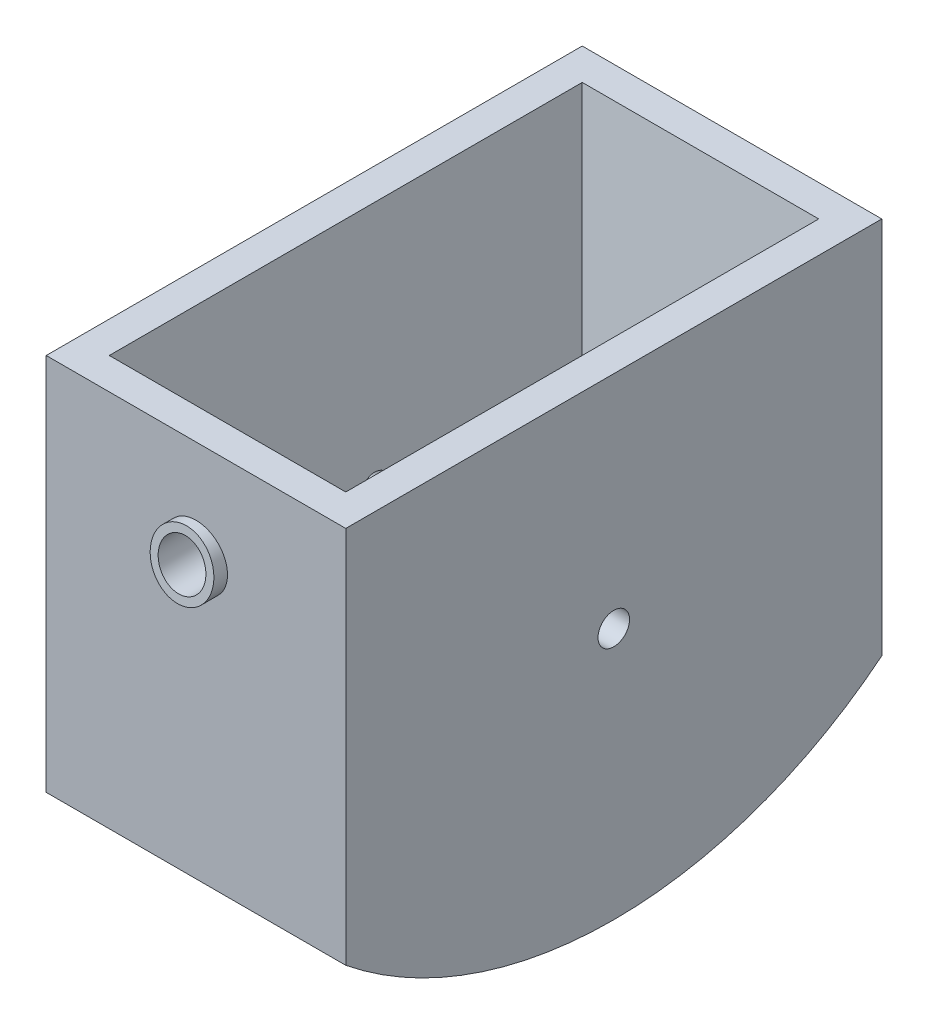
from build123d import *

# Parameters (mm, degrees)
SKETCH1_W                    = 190
SKETCH1_H                    = 340
BOSS_EXTRUDE1_DEPTH          = 300
SKETCH2_R                    = 20
SKETCH2_R_2                  = 15
BOSS_EXTRUDE2_DEPTH          = 57
CUT_EXTRUDE1_START           = -190
SKETCH5_R                    = 10
CUT_EXTRUDE1_DEPTH           = 612.460555687
CUT_EXTRUDE2_DEPTH           = 422.460555687
CUT_EXTRUDE6_START           = -236
CUT_EXTRUDE6_DEPTH           = 236
SKETCH10_OUTSIDE_W           = 383.134
SKETCH10_OUTSIDE_H           = 590.134
SKETCH10_OUTSIDE_W_2         = 190
SKETCH10_OUTSIDE_H_2         = 340
CUT_EXTRUDE7_DEPTH           = 301
CUT_EXTRUDE7_DRAFT           = -8
SKETCH10_OUTSIDE_W_3         = 150
SKETCH10_OUTSIDE_H_3         = 300
CUT_EXTRUDE7_PROFILE_2_DEPTH = 301
CUT_EXTRUDE7_PROFILE_2_DRAFT = -8


with BuildPart() as part:
    # Sketch1 → Boss-Extrude1 (new body)
    with BuildSketch(Plane(origin=(0, 0, 0), x_dir=(1, 0, 0), z_dir=(0, 1, 0))):
        Rectangle(SKETCH1_W, SKETCH1_H)
    extrude(amount=BOSS_EXTRUDE1_DEPTH)

    # Sketch2 → Boss-Extrude2 (add)
    with BuildSketch(Plane.XY.offset(170)):
        with Locations(Location((0, 237, 0), (0, 0, 180))):
            Circle(SKETCH2_R)
        with Locations(Location((0, 237, 0), (0, 0, 180))):
            Circle(SKETCH2_R_2, mode=Mode.SUBTRACT)
    extrude(amount=BOSS_EXTRUDE2_DEPTH)

    # Sketch5 → Cut-Extrude1 (cut, through all)
    with BuildSketch(Plane.ZY.offset(95).offset(CUT_EXTRUDE1_START)):
        with Locations((0, 160)):
            Circle(SKETCH5_R)
    extrude(amount=CUT_EXTRUDE1_DEPTH, mode=Mode.SUBTRACT)

    # Sketch9 → Cut-Extrude2 (cut, through all)
    with BuildSketch(Plane.ZY.offset(95)):
        with BuildLine():
            ThreePointArc((0, 0), (-90.138848958, 15.439927953), (-170, 60))
            Line((-170, 60), (-170, 0))
            Line((-170, 0), (0, 0))
        make_face()
        with BuildLine():
            ThreePointArc((170, 60), (90.138848958, 15.439927953), (0, 0))
            Line((0, 0), (170, 0))
            Line((170, 0), (170, 60))
        make_face()
    extrude(amount=-CUT_EXTRUDE2_DEPTH, mode=Mode.SUBTRACT)

    # Sketch2<3> → Cut-Extrude6 (cut)
    with BuildSketch(Plane.XY.offset(170).offset(CUT_EXTRUDE6_START)):
        with BuildLine():
            ThreePointArc((-15, 237), (0, 222), (15, 237))
            Line((15, 237), (-15, 237))
        make_face()
        with BuildLine():
            Line((-15, 237), (15, 237))
            ThreePointArc((15, 237), (0, 252), (-15, 237))
        make_face()
    extrude(amount=CUT_EXTRUDE6_DEPTH, mode=Mode.SUBTRACT)


with BuildPart() as cut_extrude7_tool:
    # Sketch10 outside → Cut-Extrude7 (with draft: the straight prism first)
    with BuildSketch(Plane(origin=(0, 300, 0), x_dir=(1, 0, 0), z_dir=(0, 1, 0))):
        with Locations((0, -28.5)):
            Rectangle(SKETCH10_OUTSIDE_W, SKETCH10_OUTSIDE_H)
        Rectangle(SKETCH10_OUTSIDE_W_2, SKETCH10_OUTSIDE_H_2, mode=Mode.SUBTRACT)
    extrude(amount=-CUT_EXTRUDE7_DEPTH)
    # Cut-Extrude7: the draft: its side faces are tilted about the plane it starts from
    cut_extrude7_sides = [cut_extrude7_tool.faces().sort_by_distance(p)[0] for p in [
        (0, 149.5, 323.567),
        (191.567, 149.5, 28.5),
        (0, 149.5, -266.567),
        (-191.567, 149.5, 28.5),
        (0, 149.5, -170),
        (95, 149.5, 0),
        (0, 149.5, 170),
        (-95, 149.5, 0),
    ]]
    draft(cut_extrude7_sides, Plane(origin=(0, 300, 0), x_dir=(1, 0, 0), z_dir=(0, 1, 0)), CUT_EXTRUDE7_DRAFT)


with BuildPart() as part_1:
    add(part.part)

    # Cut-Extrude7: cut by cut_extrude7_tool
    add(cut_extrude7_tool.part, mode=Mode.SUBTRACT)


with BuildPart() as cut_extrude7_profile_2_tool:
    # Sketch10 outside → Cut-Extrude7 profile 2 (with draft: the straight prism first)
    with BuildSketch(Plane(origin=(0, 300, 0), x_dir=(1, 0, 0), z_dir=(0, 1, 0))):
        Rectangle(SKETCH10_OUTSIDE_W_3, SKETCH10_OUTSIDE_H_3)
    extrude(amount=-CUT_EXTRUDE7_PROFILE_2_DEPTH)
    # Cut-Extrude7 profile 2: the draft: its side faces are tilted about the plane it starts from
    cut_extrude7_profile_2_sides = [cut_extrude7_profile_2_tool.faces().sort_by_distance(p)[0] for p in [
        (-75, 149.5, 0),
        (0, 149.5, 150),
        (75, 149.5, 0),
        (0, 149.5, -150),
    ]]
    draft(cut_extrude7_profile_2_sides, Plane(origin=(0, 300, 0), x_dir=(1, 0, 0), z_dir=(0, 1, 0)), CUT_EXTRUDE7_PROFILE_2_DRAFT)


with BuildPart() as part_2:
    add(part_1.part)

    # Cut-Extrude7 profile 2: cut by cut_extrude7_profile_2_tool
    add(cut_extrude7_profile_2_tool.part, mode=Mode.SUBTRACT)


solid = part_2.part
